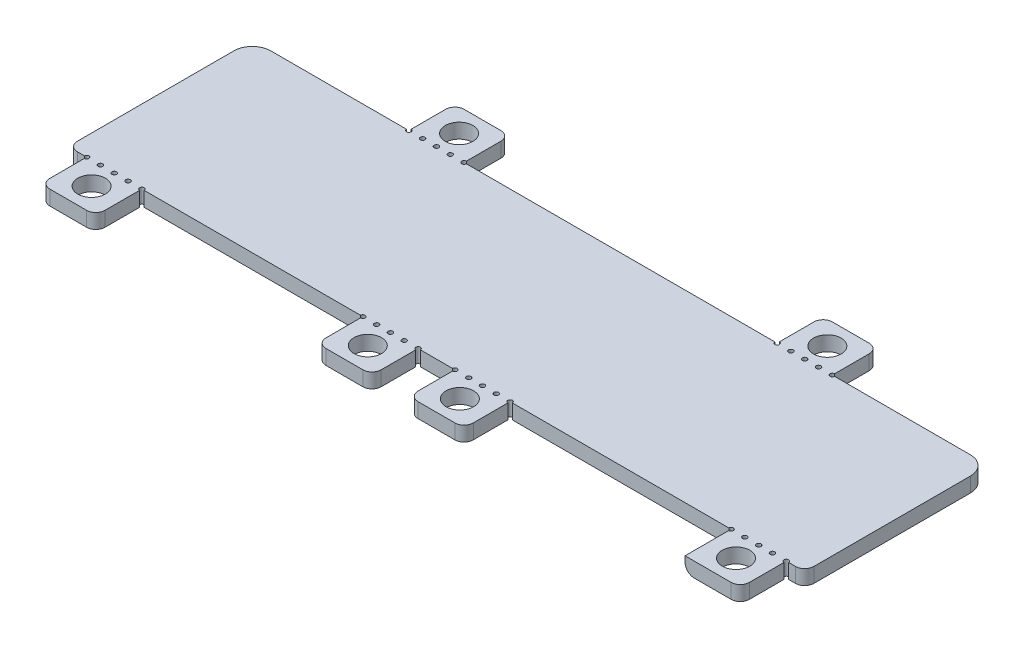
from build123d import *

# Parameters (mm, degrees)
SKETCH_1_W          = 6
SKETCH_1_H          = 5
SKETCH_1_W_2        = 80
SKETCH_1_H_2        = 20
EXTRUDE_1_DEPTH     = 1.6
SKETCH_2_R          = 1.5
CUT_EXTRUDE_1_DEPTH = 43.74997076
FILLET_1_R          = 1
SKETCH_3_R          = 0.25
CUT_EXTRUDE_2_DEPTH = 43.74997076
FILLET_2_R          = 2


with BuildPart() as part:
    # Эскиз1 → Бобышка-Вытянуть1 (new body)
    with BuildSketch(Plane(origin=(0, 0, 0), x_dir=(1, 0, 0), z_dir=(0, 1, 0))):
        with Locations((-20, 12.5)):
            Rectangle(SKETCH_1_W, SKETCH_1_H)
        Rectangle(SKETCH_1_W_2, SKETCH_1_H_2)
        with Locations((20, 12.5)):
            Rectangle(SKETCH_1_W, SKETCH_1_H)
        with Locations((35, -12.5)):
            Rectangle(SKETCH_1_W, SKETCH_1_H)
        with Locations((5, -12.5)):
            Rectangle(SKETCH_1_W, SKETCH_1_H)
        with Locations((-5, -12.5)):
            Rectangle(SKETCH_1_W, SKETCH_1_H)
        with Locations((-35, -12.5)):
            Rectangle(SKETCH_1_W, SKETCH_1_H)
    extrude(amount=EXTRUDE_1_DEPTH)

    # Эскиз2 → Вырез-Вытянуть1 (cut, through all)
    with BuildSketch(Plane(origin=(0, 1.6, 0), x_dir=(1, 0, 0), z_dir=(0, 1, 0))):
        with Locations(Location((-20, 12.46, 0), (0, 0, 270))):
            Circle(SKETCH_2_R)
        with Locations(Location((-35, -12.46, 0), (0, 0, 270))):
            Circle(SKETCH_2_R)
        with Locations(Location((-5, -12.46, 0), (0, 0, 270))):
            Circle(SKETCH_2_R)
        with Locations(Location((5, -12.46, 0), (0, 0, 90))):
            Circle(SKETCH_2_R)
        with Locations(Location((35, -12.46, 0), (0, 0, 90))):
            Circle(SKETCH_2_R)
        with Locations(Location((20, 12.46, 0), (0, 0, 90))):
            Circle(SKETCH_2_R)
    extrude(amount=-CUT_EXTRUDE_1_DEPTH, mode=Mode.SUBTRACT)

    # Скругление1
    fillet_1_edges = [part.edges().sort_by_distance(p)[0] for p in [
        (32, 0, 12.5),
        (-23, 0.8, -15),
        (-17, 0.8, -15),
        (17, 0.8, -15),
        (23, 0.8, -15),
        (40, 0.8, 10),
        (38, 0.8, 15),
        (8, 0.8, 15),
        (2, 0.8, 15),
        (-2, 0.8, 15),
        (-8, 0.8, 15),
        (-32, 0.8, 15),
        (-38, 0.8, 15),
        (-40, 0.8, 10),
    ]]
    fillet(fillet_1_edges, radius=FILLET_1_R)

    # Эскиз3 → Вырез-Вытянуть2 (cut, through all)
    with BuildSketch(Plane(origin=(0, 1.6, 0), x_dir=(1, 0, 0), z_dir=(0, 1, 0))):
        with Locations((-23, 10)):
            Circle(SKETCH_3_R)
        with Locations(Location((-21.5, 10, 0), (0, 0, 270))):
            Circle(SKETCH_3_R)
        with Locations(Location((-20, 10, 0), (0, 0, 270))):
            Circle(SKETCH_3_R)
        with Locations(Location((-18.5, 10, 0), (0, 0, 270))):
            Circle(SKETCH_3_R)
        with Locations((-17, 10)):
            Circle(SKETCH_3_R)
        with Locations((-38, -10)):
            Circle(SKETCH_3_R)
        with Locations(Location((-36.5, -10, 0), (0, 0, 270))):
            Circle(SKETCH_3_R)
        with Locations(Location((-35, -10, 0), (0, 0, 270))):
            Circle(SKETCH_3_R)
        with Locations(Location((-33.5, -10, 0), (0, 0, 270))):
            Circle(SKETCH_3_R)
        with Locations((-32, -10)):
            Circle(SKETCH_3_R)
        with Locations((-8, -10)):
            Circle(SKETCH_3_R)
        with Locations(Location((-6.5, -10, 0), (0, 0, 270))):
            Circle(SKETCH_3_R)
        with Locations(Location((-5, -10, 0), (0, 0, 270))):
            Circle(SKETCH_3_R)
        with Locations(Location((-3.5, -10, 0), (0, 0, 270))):
            Circle(SKETCH_3_R)
        with Locations((-2, -10)):
            Circle(SKETCH_3_R)
        with Locations((2, -10)):
            Circle(SKETCH_3_R)
        with Locations(Location((3.5, -10, 0), (0, 0, 90))):
            Circle(SKETCH_3_R)
        with Locations(Location((5, -10, 0), (0, 0, 90))):
            Circle(SKETCH_3_R)
        with Locations(Location((6.5, -10, 0), (0, 0, 90))):
            Circle(SKETCH_3_R)
        with Locations((8, -10)):
            Circle(SKETCH_3_R)
        with Locations((32, -10)):
            Circle(SKETCH_3_R)
        with Locations(Location((33.5, -10, 0), (0, 0, 90))):
            Circle(SKETCH_3_R)
        with Locations(Location((35, -10, 0), (0, 0, 90))):
            Circle(SKETCH_3_R)
        with Locations(Location((36.5, -10, 0), (0, 0, 90))):
            Circle(SKETCH_3_R)
        with Locations((38, -10)):
            Circle(SKETCH_3_R)
        with Locations((17, 10)):
            Circle(SKETCH_3_R)
        with Locations(Location((18.5, 10, 0), (0, 0, 90))):
            Circle(SKETCH_3_R)
        with Locations(Location((20, 10, 0), (0, 0, 90))):
            Circle(SKETCH_3_R)
        with Locations(Location((21.5, 10, 0), (0, 0, 90))):
            Circle(SKETCH_3_R)
        with Locations((23, 10)):
            Circle(SKETCH_3_R)
    extrude(amount=-CUT_EXTRUDE_2_DEPTH, mode=Mode.SUBTRACT)

    # Скругление2
    fillet_2_edges = [part.edges().sort_by_distance(p)[0] for p in [
        (40, 0.8, -10),
        (-40, 0.8, -10),
    ]]
    fillet(fillet_2_edges, radius=FILLET_2_R)


solid = part.part
